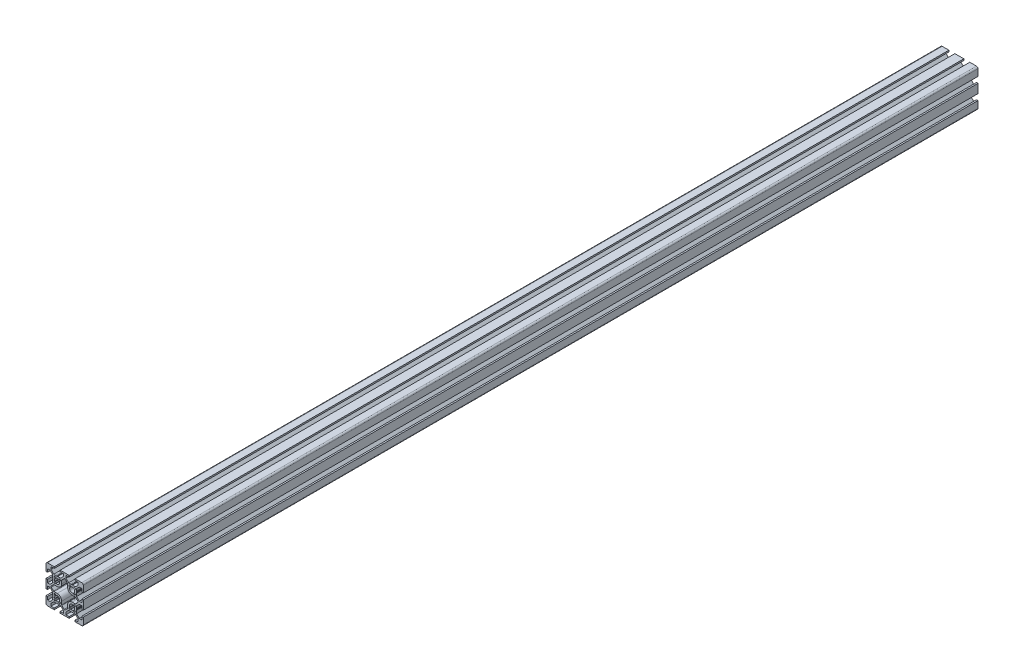
from build123d import *

# Parameters (mm, degrees)
BOSS_EXTRUDE1_DEPTH = 1200
CUT_EXTRUDE1_DEPTH  = 1201.520720354
CUT_EXTRUDE2_DEPTH  = 1201.520720354
CUT_EXTRUDE3_DEPTH  = 1201.520720354
CUT_EXTRUDE4_DEPTH  = 1201.520720354


with BuildPart() as part:
    # Sketch1 → Boss-Extrude1 (new body)
    with BuildSketch(Plane.XY):
        with BuildLine():
            Line((-25, 23), (-25, 14))
            Line((-25, 14), (-23, 14))
            Line((-23, 14), (-23, 18.25))
            Line((-23, 18.25), (-19.664213562, 18.25))
            Line((-19.664213562, 18.25), (-16, 14.585786438))
            Line((-16, 14.585786438), (-16, 10.653589838))
            ThreePointArc((-16, 10.653589838), (-15.982962913, 10.524180316), (-15.933012702, 10.403589838))
            Line((-15.933012702, 10.403589838), (-15.7, 10))
            Line((-15.7, 10), (-15.933012702, 9.596410162))
            ThreePointArc((-15.933012702, 9.596410162), (-16, 9.346410162), (-15.933012702, 9.096410162))
            Line((-15.933012702, 9.096410162), (-15.750976592, 8.781114371))
            Line((-15.750976592, 8.781114371), (-16, 7.5))
            Line((-16, 7.5), (-16, 5.414213562))
            Line((-16, 5.414213562), (-19.664213562, 1.75))
            Line((-19.664213562, 1.75), (-23, 1.75))
            Line((-23, 1.75), (-23, 6))
            Line((-23, 6), (-25, 6))
            Line((-25, 6), (-25, -6))
            Line((-25, -6), (-23, -6))
            Line((-23, -6), (-23, -1.75))
            Line((-23, -1.75), (-19.664213562, -1.75))
            Line((-19.664213562, -1.75), (-16, -5.414213562))
            Line((-16, -5.414213562), (-16, -9.346410162))
            ThreePointArc((-16, -9.346410162), (-15.982962913, -9.475819684), (-15.933012702, -9.596410162))
            Line((-15.933012702, -9.596410162), (-15.7, -10))
            Line((-15.7, -10), (-15.933012702, -10.403589838))
            ThreePointArc((-15.933012702, -10.403589838), (-16, -10.653589838), (-15.933012702, -10.903589838))
            Line((-15.933012702, -10.903589838), (-15.750976592, -11.218885629))
            Line((-15.750976592, -11.218885629), (-16, -12.5))
            Line((-16, -12.5), (-16, -14.585786438))
            Line((-16, -14.585786438), (-19.664213562, -18.25))
            Line((-19.664213562, -18.25), (-23, -18.25))
            Line((-23, -18.25), (-23, -14))
            Line((-23, -14), (-25, -14))
            Line((-25, -14), (-25, -23))
            ThreePointArc((-25, -23), (-24.414213562, -24.414213562), (-23, -25))
            Line((-23, -25), (-14, -25))
            Line((-14, -25), (-14, -23))
            Line((-14, -23), (-18.25, -23))
            Line((-18.25, -23), (-18.25, -19.664213562))
            Line((-18.25, -19.664213562), (-14.585786438, -16))
            Line((-14.585786438, -16), (-10.653589838, -16))
            ThreePointArc((-10.653589838, -16), (-10.524180316, -15.982962913), (-10.403589838, -15.933012702))
            Line((-10.403589838, -15.933012702), (-10, -15.7))
            Line((-10, -15.7), (-9.596410162, -15.933012702))
            ThreePointArc((-9.596410162, -15.933012702), (-9.346410162, -16), (-9.096410162, -15.933012702))
            Line((-9.096410162, -15.933012702), (-8.781114371, -15.750976592))
            Line((-8.781114371, -15.750976592), (-7.5, -16))
            Line((-7.5, -16), (-5.414213562, -16))
            Line((-5.414213562, -16), (-1.75, -19.664213562))
            Line((-1.75, -19.664213562), (-1.75, -23))
            Line((-1.75, -23), (-6, -23))
            Line((-6, -23), (-6, -25))
            Line((-6, -25), (6, -25))
            Line((6, -25), (6, -23))
            Line((6, -23), (1.75, -23))
            Line((1.75, -23), (1.75, -19.664213562))
            Line((1.75, -19.664213562), (5.414213562, -16))
            Line((5.414213562, -16), (9.346410162, -16))
            ThreePointArc((9.346410162, -16), (9.475819684, -15.982962913), (9.596410162, -15.933012702))
            Line((9.596410162, -15.933012702), (10, -15.7))
            Line((10, -15.7), (10.403589838, -15.933012702))
            ThreePointArc((10.403589838, -15.933012702), (10.653589838, -16), (10.903589838, -15.933012702))
            Line((10.903589838, -15.933012702), (11.218885629, -15.750976592))
            Line((11.218885629, -15.750976592), (12.5, -16))
            Line((12.5, -16), (14.585786438, -16))
            Line((14.585786438, -16), (18.25, -19.664213562))
            Line((18.25, -19.664213562), (18.25, -23))
            Line((18.25, -23), (14, -23))
            Line((14, -23), (14, -25))
            Line((14, -25), (23, -25))
            ThreePointArc((23, -25), (24.414213562, -24.414213562), (25, -23))
            Line((25, -23), (25, -14))
            Line((25, -14), (23, -14))
            Line((23, -14), (23, -18.25))
            Line((23, -18.25), (19.664213562, -18.25))
            Line((19.664213562, -18.25), (16, -14.585786438))
            Line((16, -14.585786438), (16, -10.653589838))
            ThreePointArc((16, -10.653589838), (15.982962913, -10.524180316), (15.933012702, -10.403589838))
            Line((15.933012702, -10.403589838), (15.7, -10))
            Line((15.7, -10), (15.933012702, -9.596410162))
            ThreePointArc((15.933012702, -9.596410162), (16, -9.346410162), (15.933012702, -9.096410162))
            Line((15.933012702, -9.096410162), (15.750976592, -8.781114371))
            Line((15.750976592, -8.781114371), (16, -7.5))
            Line((16, -7.5), (16, -5.414213562))
            Line((16, -5.414213562), (19.664213562, -1.75))
            Line((19.664213562, -1.75), (23, -1.75))
            Line((23, -1.75), (23, -6))
            Line((23, -6), (25, -6))
            Line((25, -6), (25, 6))
            Line((25, 6), (23, 6))
            Line((23, 6), (23, 1.75))
            Line((23, 1.75), (19.664213562, 1.75))
            Line((19.664213562, 1.75), (16, 5.414213562))
            Line((16, 5.414213562), (16, 9.346410162))
            ThreePointArc((16, 9.346410162), (15.982962913, 9.475819684), (15.933012702, 9.596410162))
            Line((15.933012702, 9.596410162), (15.7, 10))
            Line((15.7, 10), (15.933012702, 10.403589838))
            ThreePointArc((15.933012702, 10.403589838), (16, 10.653589838), (15.933012702, 10.903589838))
            Line((15.933012702, 10.903589838), (15.750976592, 11.218885629))
            Line((15.750976592, 11.218885629), (16, 12.5))
            Line((16, 12.5), (16, 14.585786438))
            Line((16, 14.585786438), (19.664213562, 18.25))
            Line((19.664213562, 18.25), (23, 18.25))
            Line((23, 18.25), (23, 14))
            Line((23, 14), (25, 14))
            Line((25, 14), (25, 23))
            ThreePointArc((25, 23), (24.414213562, 24.414213562), (23, 25))
            Line((23, 25), (14, 25))
            Line((14, 25), (14, 23))
            Line((14, 23), (18.25, 23))
            Line((18.25, 23), (18.25, 19.664213562))
            Line((18.25, 19.664213562), (14.585786438, 16))
            Line((14.585786438, 16), (10.653589838, 16))
            ThreePointArc((10.653589838, 16), (10.524180316, 15.982962913), (10.403589838, 15.933012702))
            Line((10.403589838, 15.933012702), (10, 15.7))
            Line((10, 15.7), (9.596410162, 15.933012702))
            ThreePointArc((9.596410162, 15.933012702), (9.346410162, 16), (9.096410162, 15.933012702))
            Line((9.096410162, 15.933012702), (8.781114371, 15.750976592))
            Line((8.781114371, 15.750976592), (7.5, 16))
            Line((7.5, 16), (5.414213562, 16))
            Line((5.414213562, 16), (1.75, 19.664213562))
            Line((1.75, 19.664213562), (1.75, 23))
            Line((1.75, 23), (6, 23))
            Line((6, 23), (6, 25))
            Line((6, 25), (-6, 25))
            Line((-6, 25), (-6, 23))
            Line((-6, 23), (-1.75, 23))
            Line((-1.75, 23), (-1.75, 19.664213562))
            Line((-1.75, 19.664213562), (-5.414213562, 16))
            Line((-5.414213562, 16), (-9.346410162, 16))
            ThreePointArc((-9.346410162, 16), (-9.475819684, 15.982962913), (-9.596410162, 15.933012702))
            Line((-9.596410162, 15.933012702), (-10, 15.7))
            Line((-10, 15.7), (-10.403589838, 15.933012702))
            ThreePointArc((-10.403589838, 15.933012702), (-10.653589838, 16), (-10.903589838, 15.933012702))
            Line((-10.903589838, 15.933012702), (-11.218885629, 15.750976592))
            Line((-11.218885629, 15.750976592), (-12.5, 16))
            Line((-12.5, 16), (-14.585786438, 16))
            Line((-14.585786438, 16), (-18.25, 19.664213562))
            Line((-18.25, 19.664213562), (-18.25, 23))
            Line((-18.25, 23), (-14, 23))
            Line((-14, 23), (-14, 25))
            Line((-14, 25), (-23, 25))
            ThreePointArc((-23, 25), (-24.414213562, 24.414213562), (-25, 23))
        make_face()
        with BuildLine():
            Line((-17.878679656, -0.707106781), (-14.878679656, -3.707106781))
            ThreePointArc((-14.878679656, -3.707106781), (-14.554256308, -3.923879533), (-14.171572875, -4))
            Line((-14.171572875, -4), (-10, -4))
            ThreePointArc((-10, -4), (-5.757359313, -5.757359313), (-4, -10))
            Line((-4, -10), (-4, -14.171572875))
            ThreePointArc((-4, -14.171572875), (-3.923879533, -14.554256308), (-3.707106781, -14.878679656))
            Line((-3.707106781, -14.878679656), (-0.707106781, -17.878679656))
            ThreePointArc((-0.707106781, -17.878679656), (0, -18.171572875), (0.707106781, -17.878679656))
            Line((0.707106781, -17.878679656), (3.707106781, -14.878679656))
            ThreePointArc((3.707106781, -14.878679656), (3.923879533, -14.554256308), (4, -14.171572875))
            Line((4, -14.171572875), (4, -10))
            ThreePointArc((4, -10), (5.757359313, -5.757359313), (10, -4))
            Line((10, -4), (14.171572875, -4))
            ThreePointArc((14.171572875, -4), (14.554256308, -3.923879533), (14.878679656, -3.707106781))
            Line((14.878679656, -3.707106781), (17.878679656, -0.707106781))
            ThreePointArc((17.878679656, -0.707106781), (18.171572875, 0), (17.878679656, 0.707106781))
            Line((17.878679656, 0.707106781), (14.878679656, 3.707106781))
            ThreePointArc((14.878679656, 3.707106781), (14.554256308, 3.923879533), (14.171572875, 4))
            Line((14.171572875, 4), (10, 4))
            ThreePointArc((10, 4), (5.757359313, 5.757359313), (4, 10))
            Line((4, 10), (4, 14.171572875))
            ThreePointArc((4, 14.171572875), (3.923879533, 14.554256308), (3.707106781, 14.878679656))
            Line((3.707106781, 14.878679656), (0.707106781, 17.878679656))
            ThreePointArc((0.707106781, 17.878679656), (0, 18.171572875), (-0.707106781, 17.878679656))
            Line((-0.707106781, 17.878679656), (-3.707106781, 14.878679656))
            ThreePointArc((-3.707106781, 14.878679656), (-3.923879533, 14.554256308), (-4, 14.171572875))
            Line((-4, 14.171572875), (-4, 10))
            ThreePointArc((-4, 10), (-5.757359313, 5.757359313), (-10, 4))
            Line((-10, 4), (-14.171572875, 4))
            ThreePointArc((-14.171572875, 4), (-14.554256308, 3.923879533), (-14.878679656, 3.707106781))
            Line((-14.878679656, 3.707106781), (-17.878679656, 0.707106781))
            ThreePointArc((-17.878679656, 0.707106781), (-18.171572875, 0), (-17.878679656, -0.707106781))
        make_face(mode=Mode.SUBTRACT)
    extrude(amount=-BOSS_EXTRUDE1_DEPTH)

    # Sketch2 → Cut-Extrude1 (cut, through all)
    with BuildSketch(Plane.XY):
        with BuildLine():
            Line((-14.242640687, 12.828427125), (-13.205105981, 11.790892418))
            ThreePointArc((-13.205105981, 11.790892418), (-13.095045749, 11.583064884), (-13.120796199, 11.349307631))
            ThreePointArc((-13.120796199, 11.349307631), (-13.4, 10.000000021), (-13.120796216, 8.650692407))
            ThreePointArc((-13.120796216, 8.650692407), (-13.095045745, 8.416935137), (-13.205105981, 8.209107582))
            Line((-13.205105981, 8.209107582), (-14.242640687, 7.171572875))
            ThreePointArc((-14.242640687, 7.171572875), (-14.389087297, 6.818019485), (-14.242640687, 6.464466094))
            Line((-14.242640687, 6.464466094), (-13.535533906, 5.757359313))
            ThreePointArc((-13.535533906, 5.757359313), (-13.181980515, 5.610912703), (-12.828427125, 5.757359313))
            Line((-12.828427125, 5.757359313), (-11.790892418, 6.794894019))
            ThreePointArc((-11.790892418, 6.794894019), (-11.583064884, 6.904954251), (-11.349307631, 6.879203801))
            ThreePointArc((-11.349307631, 6.879203801), (-7.595836944, 7.595836944), (-6.879203801, 11.349307631))
            ThreePointArc((-6.879203801, 11.349307631), (-6.904954251, 11.583064884), (-6.794894019, 11.790892418))
            Line((-6.794894019, 11.790892418), (-5.757359313, 12.828427125))
            ThreePointArc((-5.757359313, 12.828427125), (-5.610912703, 13.181980515), (-5.757359313, 13.535533906))
            Line((-5.757359313, 13.535533906), (-6.464466094, 14.242640687))
            ThreePointArc((-6.464466094, 14.242640687), (-6.818019485, 14.389087297), (-7.171572875, 14.242640687))
            Line((-7.171572875, 14.242640687), (-8.209107582, 13.205105981))
            ThreePointArc((-8.209107582, 13.205105981), (-8.416935116, 13.095045749), (-8.650692369, 13.120796199))
            ThreePointArc((-8.650692369, 13.120796199), (-9.999999979, 13.4), (-11.349307593, 13.120796216))
            ThreePointArc((-11.349307593, 13.120796216), (-11.583064863, 13.095045745), (-11.790892418, 13.205105981))
            Line((-11.790892418, 13.205105981), (-12.828427125, 14.242640687))
            ThreePointArc((-12.828427125, 14.242640687), (-13.181980515, 14.389087297), (-13.535533906, 14.242640687))
            Line((-13.535533906, 14.242640687), (-14.242640687, 13.535533906))
            ThreePointArc((-14.242640687, 13.535533906), (-14.389087297, 13.181980515), (-14.242640687, 12.828427125))
        make_face()
    extrude(amount=-CUT_EXTRUDE1_DEPTH, mode=Mode.SUBTRACT)

    # Sketch3 → Cut-Extrude2 (cut, through all)
    with BuildSketch(Plane.XY):
        with BuildLine():
            Line((-12.828427125, -14.242640687), (-11.790892418, -13.205105981))
            ThreePointArc((-11.790892418, -13.205105981), (-11.583064884, -13.095045749), (-11.349307631, -13.120796199))
            ThreePointArc((-11.349307631, -13.120796199), (-10.000000021, -13.4), (-8.650692407, -13.120796216))
            ThreePointArc((-8.650692407, -13.120796216), (-8.416935137, -13.095045745), (-8.209107582, -13.205105981))
            Line((-8.209107582, -13.205105981), (-7.171572875, -14.242640687))
            ThreePointArc((-7.171572875, -14.242640687), (-6.818019485, -14.389087297), (-6.464466094, -14.242640687))
            Line((-6.464466094, -14.242640687), (-5.757359313, -13.535533906))
            ThreePointArc((-5.757359313, -13.535533906), (-5.610912703, -13.181980515), (-5.757359313, -12.828427125))
            Line((-5.757359313, -12.828427125), (-6.794894019, -11.790892418))
            ThreePointArc((-6.794894019, -11.790892418), (-6.904954251, -11.583064884), (-6.879203801, -11.349307631))
            ThreePointArc((-6.879203801, -11.349307631), (-7.595836944, -7.595836944), (-11.349307631, -6.879203801))
            ThreePointArc((-11.349307631, -6.879203801), (-11.583064884, -6.904954251), (-11.790892418, -6.794894019))
            Line((-11.790892418, -6.794894019), (-12.828427125, -5.757359313))
            ThreePointArc((-12.828427125, -5.757359313), (-13.181980515, -5.610912703), (-13.535533906, -5.757359313))
            Line((-13.535533906, -5.757359313), (-14.242640687, -6.464466094))
            ThreePointArc((-14.242640687, -6.464466094), (-14.389087297, -6.818019485), (-14.242640687, -7.171572875))
            Line((-14.242640687, -7.171572875), (-13.205105981, -8.209107582))
            ThreePointArc((-13.205105981, -8.209107582), (-13.095045749, -8.416935116), (-13.120796199, -8.650692369))
            ThreePointArc((-13.120796199, -8.650692369), (-13.4, -9.999999979), (-13.120796216, -11.349307593))
            ThreePointArc((-13.120796216, -11.349307593), (-13.095045745, -11.583064863), (-13.205105981, -11.790892418))
            Line((-13.205105981, -11.790892418), (-14.242640687, -12.828427125))
            ThreePointArc((-14.242640687, -12.828427125), (-14.389087297, -13.181980515), (-14.242640687, -13.535533906))
            Line((-14.242640687, -13.535533906), (-13.535533906, -14.242640687))
            ThreePointArc((-13.535533906, -14.242640687), (-13.181980515, -14.389087297), (-12.828427125, -14.242640687))
        make_face()
    extrude(amount=-CUT_EXTRUDE2_DEPTH, mode=Mode.SUBTRACT)

    # Sketch4 → Cut-Extrude3 (cut, through all)
    with BuildSketch(Plane.XY):
        with BuildLine():
            Line((14.242640687, -12.828427125), (13.205105981, -11.790892418))
            ThreePointArc((13.205105981, -11.790892418), (13.095045749, -11.583064884), (13.120796199, -11.349307631))
            ThreePointArc((13.120796199, -11.349307631), (13.4, -10.000000021), (13.120796216, -8.650692407))
            ThreePointArc((13.120796216, -8.650692407), (13.095045745, -8.416935137), (13.205105981, -8.209107582))
            Line((13.205105981, -8.209107582), (14.242640687, -7.171572875))
            ThreePointArc((14.242640687, -7.171572875), (14.389087297, -6.818019485), (14.242640687, -6.464466094))
            Line((14.242640687, -6.464466094), (13.535533906, -5.757359313))
            ThreePointArc((13.535533906, -5.757359313), (13.181980515, -5.610912703), (12.828427125, -5.757359313))
            Line((12.828427125, -5.757359313), (11.790892418, -6.794894019))
            ThreePointArc((11.790892418, -6.794894019), (11.583064884, -6.904954251), (11.349307631, -6.879203801))
            ThreePointArc((11.349307631, -6.879203801), (7.595836944, -7.595836944), (6.879203801, -11.349307631))
            ThreePointArc((6.879203801, -11.349307631), (6.904954251, -11.583064884), (6.794894019, -11.790892418))
            Line((6.794894019, -11.790892418), (5.757359313, -12.828427125))
            ThreePointArc((5.757359313, -12.828427125), (5.610912703, -13.181980515), (5.757359313, -13.535533906))
            Line((5.757359313, -13.535533906), (6.464466094, -14.242640687))
            ThreePointArc((6.464466094, -14.242640687), (6.818019485, -14.389087297), (7.171572875, -14.242640687))
            Line((7.171572875, -14.242640687), (8.209107582, -13.205105981))
            ThreePointArc((8.209107582, -13.205105981), (8.416935116, -13.095045749), (8.650692369, -13.120796199))
            ThreePointArc((8.650692369, -13.120796199), (9.999999979, -13.4), (11.349307593, -13.120796216))
            ThreePointArc((11.349307593, -13.120796216), (11.583064863, -13.095045745), (11.790892418, -13.205105981))
            Line((11.790892418, -13.205105981), (12.828427125, -14.242640687))
            ThreePointArc((12.828427125, -14.242640687), (13.181980515, -14.389087297), (13.535533906, -14.242640687))
            Line((13.535533906, -14.242640687), (14.242640687, -13.535533906))
            ThreePointArc((14.242640687, -13.535533906), (14.389087297, -13.181980515), (14.242640687, -12.828427125))
        make_face()
    extrude(amount=-CUT_EXTRUDE3_DEPTH, mode=Mode.SUBTRACT)

    # Sketch5 → Cut-Extrude4 (cut, through all)
    with BuildSketch(Plane.XY):
        with BuildLine():
            Line((12.828427125, 14.242640687), (11.790892418, 13.205105981))
            ThreePointArc((11.790892418, 13.205105981), (11.583064884, 13.095045749), (11.349307631, 13.120796199))
            ThreePointArc((11.349307631, 13.120796199), (10.000000021, 13.4), (8.650692407, 13.120796216))
            ThreePointArc((8.650692407, 13.120796216), (8.416935137, 13.095045745), (8.209107582, 13.205105981))
            Line((8.209107582, 13.205105981), (7.171572875, 14.242640687))
            ThreePointArc((7.171572875, 14.242640687), (6.818019485, 14.389087297), (6.464466094, 14.242640687))
            Line((6.464466094, 14.242640687), (5.757359313, 13.535533906))
            ThreePointArc((5.757359313, 13.535533906), (5.610912703, 13.181980515), (5.757359313, 12.828427125))
            Line((5.757359313, 12.828427125), (6.794894019, 11.790892418))
            ThreePointArc((6.794894019, 11.790892418), (6.904954251, 11.583064884), (6.879203801, 11.349307631))
            ThreePointArc((6.879203801, 11.349307631), (7.595836944, 7.595836944), (11.349307631, 6.879203801))
            ThreePointArc((11.349307631, 6.879203801), (11.583064884, 6.904954251), (11.790892418, 6.794894019))
            Line((11.790892418, 6.794894019), (12.828427125, 5.757359313))
            ThreePointArc((12.828427125, 5.757359313), (13.181980515, 5.610912703), (13.535533906, 5.757359313))
            Line((13.535533906, 5.757359313), (14.242640687, 6.464466094))
            ThreePointArc((14.242640687, 6.464466094), (14.389087297, 6.818019485), (14.242640687, 7.171572875))
            Line((14.242640687, 7.171572875), (13.205105981, 8.209107582))
            ThreePointArc((13.205105981, 8.209107582), (13.095045749, 8.416935116), (13.120796199, 8.650692369))
            ThreePointArc((13.120796199, 8.650692369), (13.4, 9.999999979), (13.120796216, 11.349307593))
            ThreePointArc((13.120796216, 11.349307593), (13.095045745, 11.583064863), (13.205105981, 11.790892418))
            Line((13.205105981, 11.790892418), (14.242640687, 12.828427125))
            ThreePointArc((14.242640687, 12.828427125), (14.389087297, 13.181980515), (14.242640687, 13.535533906))
            Line((14.242640687, 13.535533906), (13.535533906, 14.242640687))
            ThreePointArc((13.535533906, 14.242640687), (13.181980515, 14.389087297), (12.828427125, 14.242640687))
        make_face()
    extrude(amount=-CUT_EXTRUDE4_DEPTH, mode=Mode.SUBTRACT)


solid = part.part
